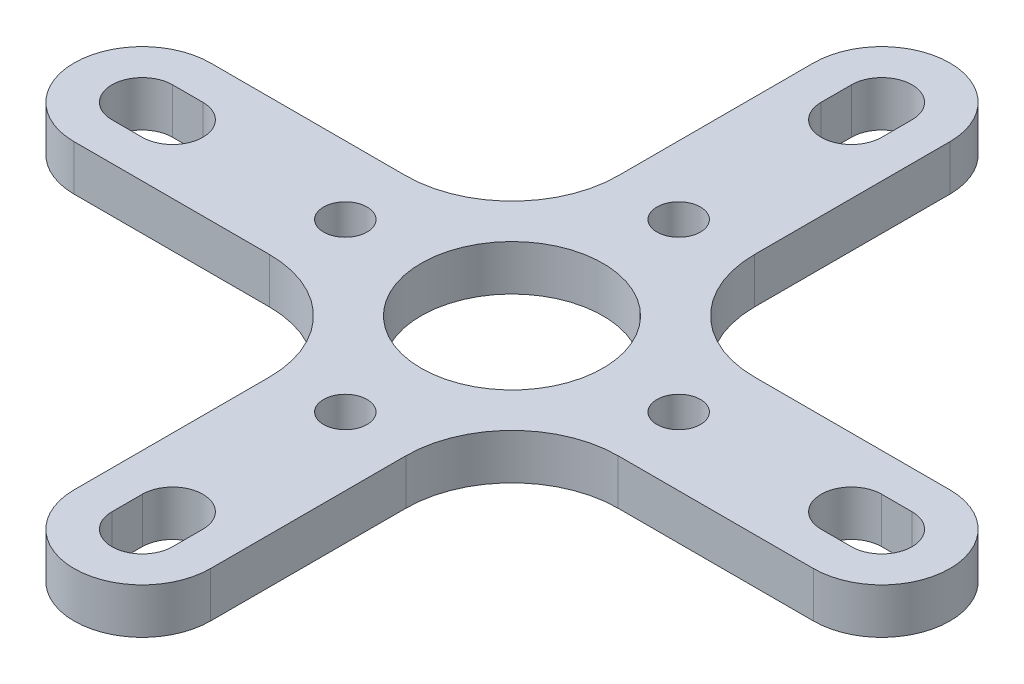
from build123d import *

# Parameters (mm, degrees)
SKETCH1_W           = 9
SKETCH1_H           = 9
BOSS_EXTRUDE1_DEPTH = 3
FILLET1_R           = 7
SKETCH2_R           = 6
CUT_EXTRUDE1_DEPTH  = 41.980727178
SKETCH5_R           = 1.4351
CUT_EXTRUDE2_DEPTH  = 41.980727178
CUT_EXTRUDE3_DEPTH  = 41.980727178


with BuildPart() as part:
    # Sketch1 → Boss-Extrude1 (new body)
    with BuildSketch(Plane(origin=(0, 0, 0), x_dir=(1, 0, 0), z_dir=(0, 1, 0))):
        with BuildLine():
            Line((4.5, -24.4), (4.5, -4.5))
            Line((4.5, -4.5), (-4.5, -4.5))
            Line((-4.5, -4.5), (-4.5, -24.4))
            ThreePointArc((-4.5, -24.4), (0, -28.9), (4.5, -24.4))
        make_face()
        Rectangle(SKETCH1_W, SKETCH1_H)
        with BuildLine():
            Line((24.4, 4.5), (4.5, 4.5))
            Line((4.5, 4.5), (4.5, -4.5))
            Line((4.5, -4.5), (24.4, -4.5))
            ThreePointArc((24.4, -4.5), (28.9, 0), (24.4, 4.5))
        make_face()
        with BuildLine():
            Line((4.5, 4.5), (4.5, 24.4))
            ThreePointArc((4.5, 24.4), (0, 28.9), (-4.5, 24.4))
            Line((-4.5, 24.4), (-4.5, 4.5))
            Line((-4.5, 4.5), (4.5, 4.5))
        make_face()
        with BuildLine():
            Line((-4.5, -4.5), (-4.5, 4.5))
            Line((-4.5, 4.5), (-24.4, 4.5))
            ThreePointArc((-24.4, 4.5), (-28.9, 0), (-24.4, -4.5))
            Line((-24.4, -4.5), (-4.5, -4.5))
        make_face()
    extrude(amount=BOSS_EXTRUDE1_DEPTH)

    # Fillet1
    fillet1_edges = [part.edges().sort_by_distance(p)[0] for p in [
        (-4.5, 1.5, 4.5),
        (-4.5, 1.5, -4.5),
        (4.5, 1.5, -4.5),
        (4.5, 1.5, 4.5),
    ]]
    fillet(fillet1_edges, radius=FILLET1_R)

    # Sketch2 → Cut-Extrude1 (cut, through all)
    with BuildSketch(Plane(origin=(0, 3, 0), x_dir=(1, 0, 0), z_dir=(0, 1, 0))):
        with Locations(Location((0, 0, 0), (0, 0, 270))):
            Circle(SKETCH2_R)
    extrude(amount=-CUT_EXTRUDE1_DEPTH, mode=Mode.SUBTRACT)

    # Sketch5 → Cut-Extrude2 (cut, through all)
    with BuildSketch(Plane(origin=(0, 3, 0), x_dir=(1, 0, 0), z_dir=(0, 1, 0))):
        with Locations(Location((-11, 0, 0), (0, 0, 270))):
            Circle(SKETCH5_R)
        with Locations(Location((0, 11, 0), (0, 0, 270))):
            Circle(SKETCH5_R)
        with Locations(Location((11, 0, 0), (0, 0, 270))):
            Circle(SKETCH5_R)
        with Locations(Location((0, -11, 0), (0, 0, 270))):
            Circle(SKETCH5_R)
    extrude(amount=-CUT_EXTRUDE2_DEPTH, mode=Mode.SUBTRACT)

    # Sketch6 → Cut-Extrude3 (cut, through all)
    with BuildSketch(Plane(origin=(0, 3, 0), x_dir=(1, 0, 0), z_dir=(0, 1, 0))):
        with BuildLine():
            Line((-22.4, -2), (-24.4, -2))
            ThreePointArc((-24.4, -2), (-26.4, 0), (-24.4, 2))
            Line((-24.4, 2), (-22.4, 2))
            ThreePointArc((-22.4, 2), (-20.4, 0), (-22.4, -2))
        make_face()
        with BuildLine():
            Line((-2, 22.4), (-2, 24.4))
            ThreePointArc((-2, 24.4), (0, 26.4), (2, 24.4))
            Line((2, 24.4), (2, 22.4))
            ThreePointArc((2, 22.4), (0, 20.4), (-2, 22.4))
        make_face()
        with BuildLine():
            Line((22.4, 2), (24.4, 2))
            ThreePointArc((24.4, 2), (26.4, 0), (24.4, -2))
            Line((24.4, -2), (22.4, -2))
            ThreePointArc((22.4, -2), (20.4, 0), (22.4, 2))
        make_face()
        with BuildLine():
            Line((2, -22.4), (2, -24.4))
            ThreePointArc((2, -24.4), (0, -26.4), (-2, -24.4))
            Line((-2, -24.4), (-2, -22.4))
            ThreePointArc((-2, -22.4), (0, -20.4), (2, -22.4))
        make_face()
    extrude(amount=-CUT_EXTRUDE3_DEPTH, mode=Mode.SUBTRACT)


solid = part.part
